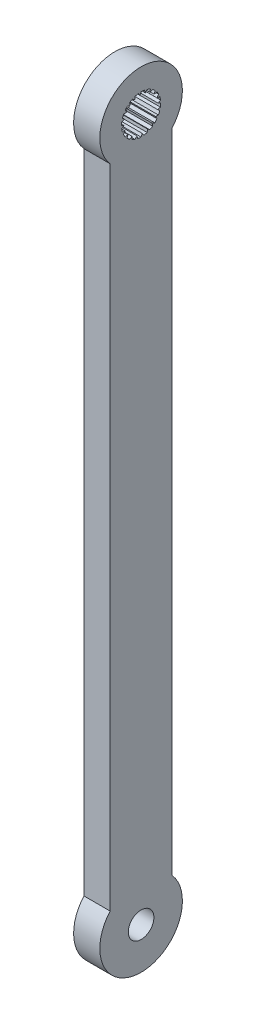
from build123d import *

# Parameters (mm, degrees)
SKETCH1_R           = 1.55
BOSS_EXTRUDE3_DEPTH = 3.175


with BuildPart() as part:
    # Sketch1 → Boss-Extrude3 (new body)
    with BuildSketch(Plane(origin=(0, 0, 0), x_dir=(0, 0, -1), z_dir=(1, 0, 0))):
        with BuildLine():
            Line((3.75, -3.307189139), (3.75, -81.692810861))
            ThreePointArc((3.75, -81.692810861), (0, -90), (-3.75, -81.692810861))
            Line((-3.75, -81.692810861), (-3.75, -3.307189139))
            ThreePointArc((-3.75, -3.307189139), (0, 5), (3.75, -3.307189139))
        make_face()
        with Locations((0, -85)):
            Circle(SKETCH1_R, mode=Mode.SUBTRACT)
        with BuildLine():
            Line((-1.754399331, 1.096511265), (-2.099123622, 1.110992809))
            ThreePointArc((-2.099123622, 1.110992809), (-2.186107384, 0.928202298), (-2.257209306, 0.738668497))
            Line((-2.257209306, 0.738668497), (-2.007373532, 0.500704976))
            Line((-2.007373532, 0.500704976), (-2.339700857, 0.407952078))
            ThreePointArc((-2.339700857, 0.407952078), (-2.365941957, 0.207228511), (-2.374994738, 0.004999452))
            Line((-2.374994738, 0.004999452), (-2.063852025, -0.144113805))
            Line((-2.063852025, -0.144113805), (-2.351251872, -0.335021845))
            ThreePointArc((-2.351251872, -0.335021845), (-2.314181647, -0.534030246), (-2.260299137, -0.729158975))
            Line((-2.260299137, -0.729158975), (-1.918306302, -0.774825723))
            Line((-1.918306302, -0.774825723), (-2.13264597, -1.045201495))
            ThreePointArc((-2.13264597, -1.045201495), (-2.035893114, -1.223014403), (-1.924349708, -1.39194224))
            Line((-1.924349708, -1.39194224), (-1.584983392, -1.329692301))
            Line((-1.584983392, -1.329692301), (-1.705281823, -1.65306954))
            ThreePointArc((-1.705281823, -1.65306954), (-1.558317177, -1.792281388), (-1.400031522, -1.918472501))
            Line((-1.400031522, -1.918472501), (-1.096511265, -1.754399331))
            Line((-1.096511265, -1.754399331), (-1.110992809, -2.099123622))
            ThreePointArc((-1.110992809, -2.099123622), (-0.928202298, -2.186107384), (-0.738668497, -2.257209306))
            Line((-0.738668497, -2.257209306), (-0.500704976, -2.007373532))
            Line((-0.500704976, -2.007373532), (-0.407952078, -2.339700857))
            ThreePointArc((-0.407952078, -2.339700857), (-0.207228511, -2.365941957), (-0.004999452, -2.374994738))
            Line((-0.004999452, -2.374994738), (0.144113805, -2.063852025))
            Line((0.144113805, -2.063852025), (0.335021845, -2.351251872))
            ThreePointArc((0.335021845, -2.351251872), (0.534030246, -2.314181647), (0.729158975, -2.260299137))
            Line((0.729158975, -2.260299137), (0.774825723, -1.918306302))
            Line((0.774825723, -1.918306302), (1.045201495, -2.13264597))
            ThreePointArc((1.045201495, -2.13264597), (1.223014403, -2.035893114), (1.39194224, -1.924349708))
            Line((1.39194224, -1.924349708), (1.329692301, -1.584983392))
            Line((1.329692301, -1.584983392), (1.65306954, -1.705281823))
            ThreePointArc((1.65306954, -1.705281823), (1.792281388, -1.558317177), (1.918472501, -1.400031522))
            Line((1.918472501, -1.400031522), (1.754399331, -1.096511265))
            Line((1.754399331, -1.096511265), (2.099123622, -1.110992809))
            ThreePointArc((2.099123622, -1.110992809), (2.186107384, -0.928202298), (2.257209306, -0.738668497))
            Line((2.257209306, -0.738668497), (2.007373532, -0.500704976))
            Line((2.007373532, -0.500704976), (2.339700857, -0.407952078))
            ThreePointArc((2.339700857, -0.407952078), (2.365941957, -0.207228511), (2.374994738, -0.004999452))
            Line((2.374994738, -0.004999452), (2.063852025, 0.144113805))
            Line((2.063852025, 0.144113805), (2.351251872, 0.335021845))
            ThreePointArc((2.351251872, 0.335021845), (2.314181647, 0.534030246), (2.260299137, 0.729158975))
            Line((2.260299137, 0.729158975), (1.918306302, 0.774825723))
            Line((1.918306302, 0.774825723), (2.13264597, 1.045201495))
            ThreePointArc((2.13264597, 1.045201495), (2.035893114, 1.223014403), (1.924349708, 1.39194224))
            Line((1.924349708, 1.39194224), (1.584983392, 1.329692301))
            Line((1.584983392, 1.329692301), (1.705281823, 1.65306954))
            ThreePointArc((1.705281823, 1.65306954), (1.558317177, 1.792281388), (1.400031522, 1.918472501))
            Line((1.400031522, 1.918472501), (1.096511265, 1.754399331))
            Line((1.096511265, 1.754399331), (1.110992809, 2.099123622))
            ThreePointArc((1.110992809, 2.099123622), (0.928202298, 2.186107384), (0.738668497, 2.257209306))
            Line((0.738668497, 2.257209306), (0.500704976, 2.007373532))
            Line((0.500704976, 2.007373532), (0.407952078, 2.339700857))
            ThreePointArc((0.407952078, 2.339700857), (0.207228511, 2.365941957), (0.004999452, 2.374994738))
            Line((0.004999452, 2.374994738), (-0.144113805, 2.063852025))
            Line((-0.144113805, 2.063852025), (-0.335021845, 2.351251872))
            ThreePointArc((-0.335021845, 2.351251872), (-0.534030246, 2.314181647), (-0.729158975, 2.260299137))
            Line((-0.729158975, 2.260299137), (-0.774825723, 1.918306302))
            Line((-0.774825723, 1.918306302), (-1.045201495, 2.13264597))
            ThreePointArc((-1.045201495, 2.13264597), (-1.223014403, 2.035893114), (-1.39194224, 1.924349708))
            Line((-1.39194224, 1.924349708), (-1.329692301, 1.584983392))
            Line((-1.329692301, 1.584983392), (-1.65306954, 1.705281823))
            ThreePointArc((-1.65306954, 1.705281823), (-1.792281388, 1.558317177), (-1.918472501, 1.400031522))
            Line((-1.918472501, 1.400031522), (-1.754399331, 1.096511265))
        make_face(mode=Mode.SUBTRACT)
    extrude(amount=BOSS_EXTRUDE3_DEPTH)


solid = part.part
